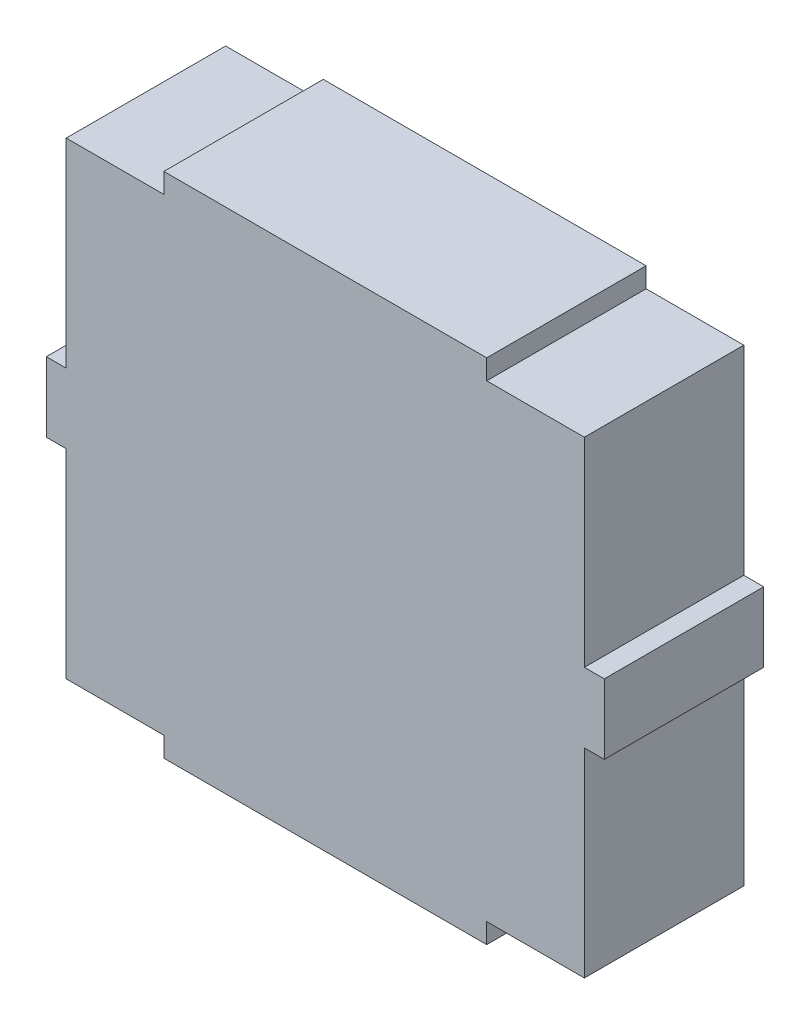
from build123d import *

# Parameters (mm, degrees)
COMPONENT_OUTLINE_DEPTH = 1.6


with BuildPart() as part:
    # 草图1 → Component_Outline (new body)
    with BuildSketch(Plane.XY):
        Polygon((-1.62, -2.55), (-1.62, -2.35), (-2.6, -2.35), (-2.6, -2.18), (-2.6, -0.35), (-2.8, -0.35), (-2.8, 0.35), (-2.6, 0.35), (-2.6, 2.35), (-1.62, 2.35), (-1.62, 2.55), (1.62, 2.55), (1.62, 2.35), (2.6, 2.35), (2.6, 0.35), (2.8, 0.35), (2.8, -0.35), (2.6, -0.35), (2.6, -2.35), (1.62, -2.35), (1.62, -2.55), align=None)
    extrude(amount=COMPONENT_OUTLINE_DEPTH)


solid = part.part
